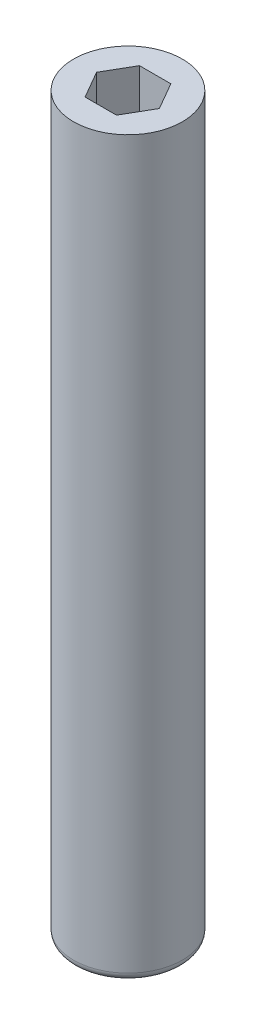
from build123d import *

# Parameters (mm, degrees)
SKETCH1_R           = 5.08
BOSS_EXTRUDE1_DEPTH = 68.58
CUT_EXTRUDE1_DEPTH  = 5.08
FILLET1_R           = 0.762


with BuildPart() as part:
    # Sketch1 → Boss-Extrude1 (new body)
    with BuildSketch(Plane(origin=(0, 0, 0), x_dir=(1, 0, 0), z_dir=(0, 1, 0))):
        with Locations(Location((0, 0, 0), (0, 0, 270))):
            Circle(SKETCH1_R)
    extrude(amount=BOSS_EXTRUDE1_DEPTH)

    # Sketch2 → Cut-Extrude1 (cut)
    with BuildSketch(Plane(origin=(0, 68.58, 0), x_dir=(1, 0, 0), z_dir=(0, 1, 0))):
        Polygon((-1.466469684, -2.54), (1.466469684, -2.54), (2.932939367, 0), (1.466469684, 2.54), (-1.466469684, 2.54), (-2.932939367, 0), align=None)
    extrude(amount=-CUT_EXTRUDE1_DEPTH, mode=Mode.SUBTRACT)

    # Fillet1
    fillet1_edges = [part.edges().sort_by_distance(p)[0] for p in [
        (0, 0, -5.08),
    ]]
    fillet(fillet1_edges, radius=FILLET1_R)


solid = part.part
